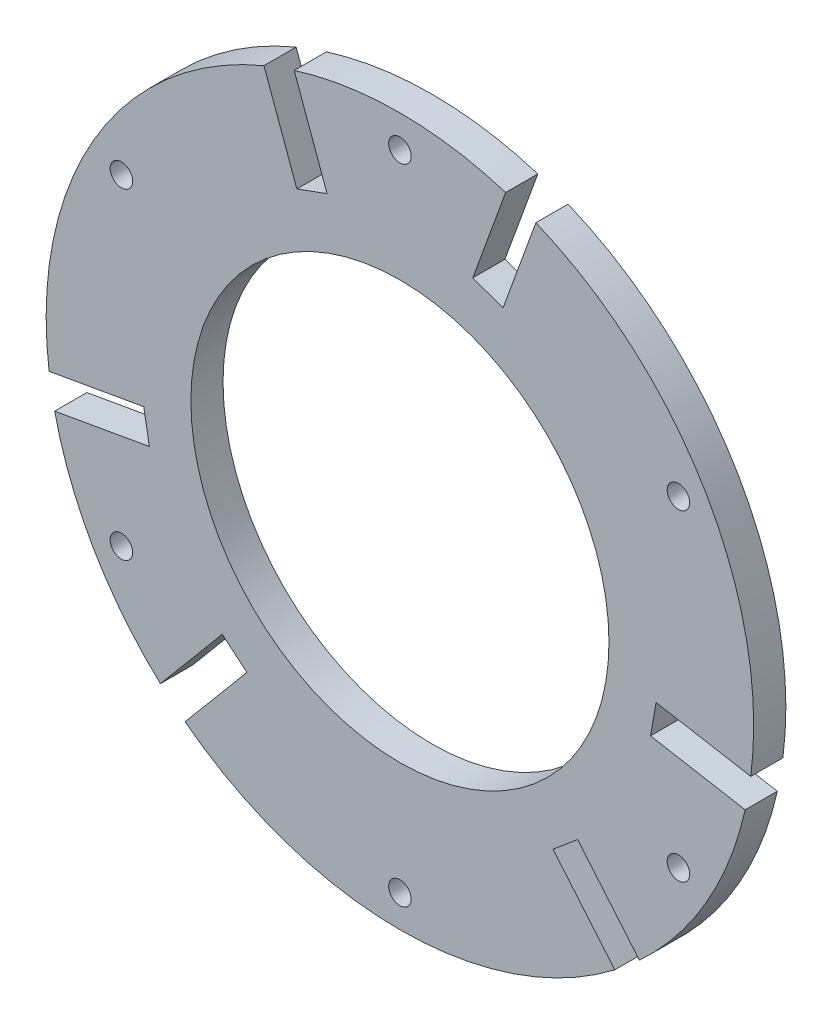
from build123d import *

# Parameters (mm, degrees)
CROQUIS1_R              = 55
SALIENTE_EXTRUIR1_DEPTH = 5
CROQUIS2_R              = 1.75
CROQUIS2_R_2            = 32.5
CORTAR_EXTRUIR1_DEPTH   = 78.942286341


with BuildPart() as part:
    # Croquis1 → Saliente-Extruir1 (new body)
    with BuildSketch(Plane.XY):
        Circle(CROQUIS1_R)
    extrude(amount=SALIENTE_EXTRUIR1_DEPTH)

    # Croquis2 → Cortar-Extruir1 (cut, through all)
    with BuildSketch(Plane.XY.offset(5)):
        with Locations((0, 50)):
            Circle(CROQUIS2_R)
        with Locations((43.301270189, 25)):
            Circle(CROQUIS2_R)
        with Locations((43.301270189, -25)):
            Circle(CROQUIS2_R)
        with Locations((0, -50)):
            Circle(CROQUIS2_R)
        with Locations((-43.301270189, -25)):
            Circle(CROQUIS2_R)
        with Locations((-43.301270189, 25)):
            Circle(CROQUIS2_R)
        with Locations((0.001598992, 0.000923179)):
            Circle(CROQUIS2_R_2)
        Polygon((-21.158630785, 50.828665682), (-16.028328636, 36.733276371), (-11.329865532, 38.443377087), (-16.460167682, 52.538766399), align=None)
        Polygon((16.028328636, 36.733276371), (11.329865532, 38.443377087), (16.460167682, 52.538766399), (21.158630785, 50.828665682), align=None)
        Polygon((54.598231114, -7.090421072), (39.826114819, -4.485698407), (38.957873931, -9.409737172), (53.729990226, -12.014459837), align=None)
        Polygon((27.628008399, -29.033639916), (37.269822544, -40.524306562), (33.439600329, -43.738244611), (23.797786183, -32.247577964), align=None)
        Polygon((-33.439600329, -43.738244611), (-23.797786183, -32.247577964), (-27.628008399, -29.033639916), (-37.269822544, -40.524306562), align=None)
        Polygon((-38.957873931, -9.409737172), (-53.729990226, -12.014459837), (-54.598231114, -7.090421072), (-39.826114819, -4.485698407), align=None)
    extrude(amount=-CORTAR_EXTRUIR1_DEPTH, mode=Mode.SUBTRACT)


solid = part.part
